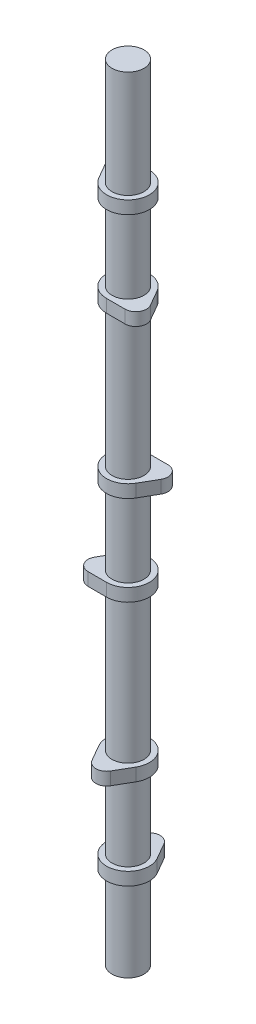
from build123d import *

# Parameters (mm, degrees)
BOSS_EXTRUDE1_DEPTH   = 7.63
LPATTERN2_COUNT       = 2
LPATTERN2_PITCH       = 53.34
BODY_MOVE_COPY1_ANGLE = 180
LPATTERN3_COUNT       = 3
LPATTERN3_PITCH       = 146.05
BODY_MOVE_COPY2_ANGLE = 120
BODY_MOVE_COPY3_ANGLE = 120
BOSS_EXTRUDE2_START   = -49.53
SKETCH3_R             = 9.5
BOSS_EXTRUDE2_DEPTH   = 466.09


with BuildPart() as part:
    # Sketch1 → Boss-Extrude1 (new body)
    with BuildSketch(Plane(origin=(0, 0, 0), x_dir=(1, 0, 0), z_dir=(0, 1, 0))):
        with BuildLine():
            Line((-5.499261314, 15.875), (-10.998522628, 6.35))
            ThreePointArc((-10.998522628, 6.35), (0, -12.7), (10.998522628, 6.35))
            Line((10.998522628, 6.35), (5.499261314, 15.875))
            ThreePointArc((5.499261314, 15.875), (0, 19.05), (-5.499261314, 15.875))
        make_face()
    extrude(amount=BOSS_EXTRUDE1_DEPTH)


with BuildPart() as lpattern2_1:
    # LPattern2: pattern copy
    add(part.part.moved(Location(Vector(0, 1, 0) * (1 * LPATTERN2_PITCH))))


with BuildPart() as lpattern2_1_1:
    # Body-Move/Copy1: moved
    add(lpattern2_1.part.rotate(Axis((0, 0, 0), (0, 1, 0)), BODY_MOVE_COPY1_ANGLE))


with BuildPart() as lpattern3_1:
    # LPattern3: pattern copy
    add(part.part.moved(Location(Vector(0, 1, 0) * (1 * LPATTERN3_PITCH))))


with BuildPart() as lpattern3_2:
    # LPattern3: pattern copy
    add(part.part.moved(Location(Vector(0, 1, 0) * (2 * LPATTERN3_PITCH))))


with BuildPart() as lpattern3_3:
    # LPattern3: pattern copy
    add(lpattern2_1_1.part.moved(Location(Vector(0, 1, 0) * (1 * LPATTERN3_PITCH))))


with BuildPart() as lpattern3_4:
    # LPattern3: pattern copy
    add(lpattern2_1_1.part.moved(Location(Vector(0, 1, 0) * (2 * LPATTERN3_PITCH))))


with BuildPart() as lpattern3_1_1:
    # Body-Move/Copy2: moved
    add(lpattern3_1.part.rotate(Axis((0, 0, 0), (0, 1, 0)), BODY_MOVE_COPY2_ANGLE))


with BuildPart() as lpattern3_3_1:
    # Body-Move/Copy2: moved
    add(lpattern3_3.part.rotate(Axis((0, 0, 0), (0, 1, 0)), BODY_MOVE_COPY2_ANGLE))


with BuildPart() as lpattern3_2_1:
    # Body-Move/Copy3: moved
    add(lpattern3_2.part.rotate(Axis((0, 0, 0), (0, -1, 0)), BODY_MOVE_COPY3_ANGLE))


with BuildPart() as lpattern3_4_1:
    # Body-Move/Copy3: moved
    add(lpattern3_4.part.rotate(Axis((0, 0, 0), (0, -1, 0)), BODY_MOVE_COPY3_ANGLE))


with BuildPart() as part_1:
    add(part.part)

    add(lpattern2_1_1.part)  # Boss-Extrude2 merges LPattern2_1

    add(lpattern3_1_1.part)  # Boss-Extrude2 merges LPattern3_1

    add(lpattern3_2_1.part)  # Boss-Extrude2 merges LPattern3_2

    add(lpattern3_3_1.part)  # Boss-Extrude2 merges LPattern3_3

    add(lpattern3_4_1.part)  # Boss-Extrude2 merges LPattern3_4
    # Sketch3 → Boss-Extrude2 (add)
    with BuildSketch(Plane(origin=(0, 0, 0), x_dir=(1, 0, 0), z_dir=(0, 1, 0)).offset(BOSS_EXTRUDE2_START)):
        Circle(SKETCH3_R)
    extrude(amount=BOSS_EXTRUDE2_DEPTH)


solid = part_1.part
